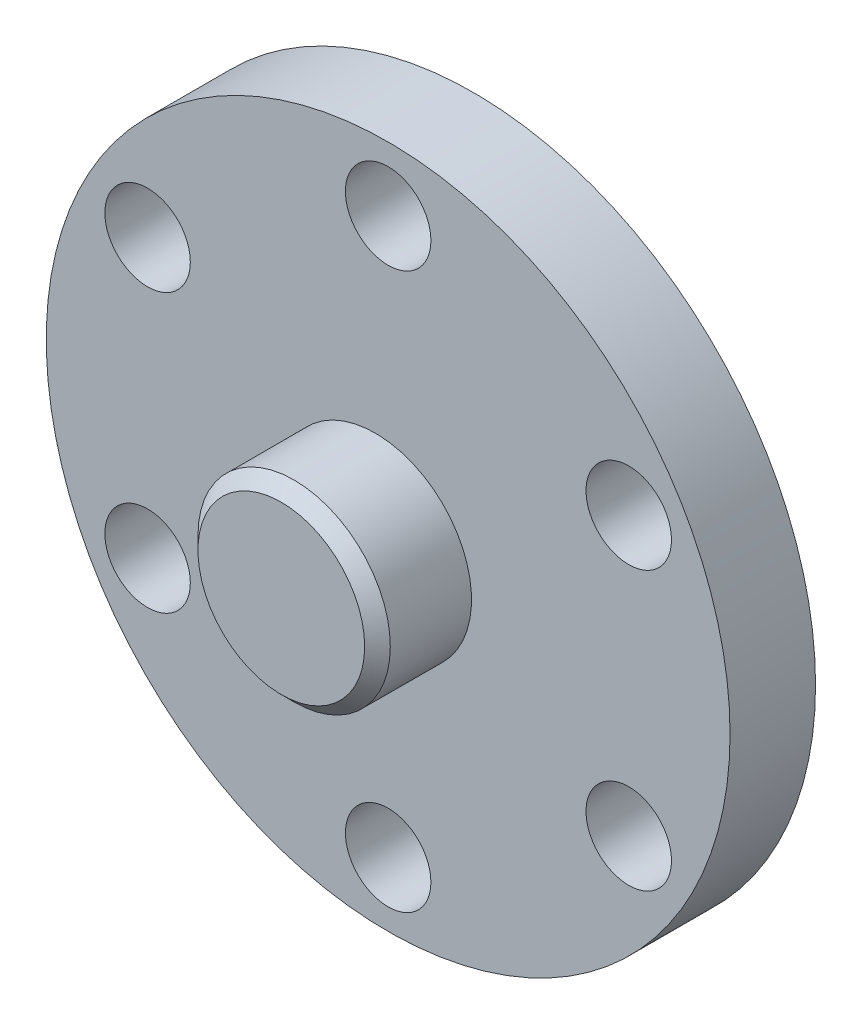
from build123d import *

# Parameters (mm, degrees)
SKETCH1_R               = 80
BASE_EXTRUDE_DEPTH      = 20
CHAMFER1_SIZE           = 3
HOLE_WIZARD_20_0_20_1_D = 20
CIRPATTERN2_COUNT       = 6


with BuildPart() as part:
    # Sketch1 → Base-Extrude (new body)
    with BuildSketch(Plane.XY):
        Circle(SKETCH1_R)
    extrude(amount=BASE_EXTRUDE_DEPTH)

    # Sketch2 → Boss-Revolve1 (revolve)
    with BuildSketch(Plane(origin=(0, 0, 0), x_dir=(1, 0, 0), z_dir=(0, 1, 0))):
        Polygon((-10, -20), (-10, -23), (-22.5, -23), (-22.5, -45), (0, -45), (0, -20), align=None)
    revolve(axis=Axis((0, 0, 0), (0, 0, 1)))

    # Chamfer1
    chamfer1_edges = [part.edges().sort_by_distance(p)[0] for p in [
        (22.5, 0, 45),
    ]]
    chamfer(chamfer1_edges, length=CHAMFER1_SIZE)

    # Ø20.0 (20) 直徑孔1 (through all)
    with Locations(Plane(origin=(0, 65, 20), x_dir=(1, 0, 0), z_dir=(0, 0, 1))):
        with Locations((0, 0)):
            hole_wizard_20_0_20_1 = Hole(HOLE_WIZARD_20_0_20_1_D / 2)

    # CirPattern2: Ø20.0 (20) 直徑孔1 ×6 about axis
    cirpattern2_axis = Axis((0, 0, 0), (0, 0, 1))
    for i in range(1, CIRPATTERN2_COUNT):
        add(hole_wizard_20_0_20_1.rotate(cirpattern2_axis, i * 360 / CIRPATTERN2_COUNT), mode=Mode.SUBTRACT)


solid = part.part
